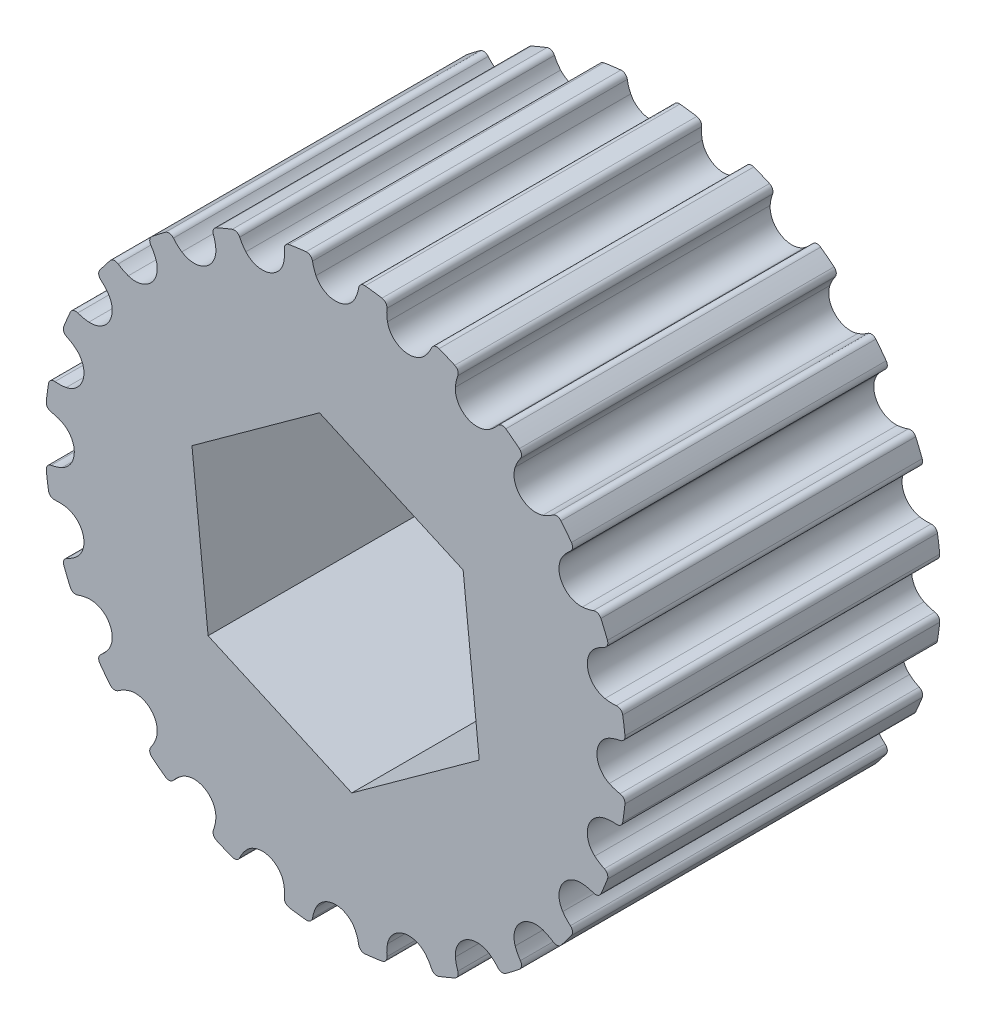
from build123d import *

# Parameters (mm, degrees)
SKETCH2_W          = 8
SKETCH2_H          = 7.3915
CUT_EXTRUDE1_REACH = 17.192
CUT_EXTRUDE1_START = 4
CIRPATTERN1_COUNT  = 24
CUT_EXTRUDE2_REACH = 15.121


with BuildPart() as part:
    # Sketch2 → Revolve1 (revolve)
    with BuildSketch(Plane(origin=(0, 0, 0), x_dir=(0, 0, -1), z_dir=(1, 0, 0))):
        with Locations((0, 3.69575)):
            Rectangle(SKETCH2_W, SKETCH2_H)
    revolve(axis=Axis((0, 0, 4), (0, 0, -1)))

    # Sketch3 → Cut-Extrude1 (cut, up to next)
    with BuildSketch(Plane.XY.offset(CUT_EXTRUDE1_START), mode=Mode.PRIVATE) as cut_extrude1_sk1:
        with BuildLine():
            Line((2.053064506, 7.6455), (-2.413874101, 7.6455))
            Line((-2.413874101, 7.6455), (-2.031951845, 7.106718226))
            ThreePointArc((-2.031951845, 7.106718226), (-1.396358482, 7.258405833), (-0.749852036, 7.35336618))
            ThreePointArc((-0.749852036, 7.35336618), (-0.643527515, 7.323301509), (-0.586639003, 7.228578306))
            ThreePointArc((-0.586639003, 7.228578306), (-0.552752294, 7.087751639), (-0.498876404, 6.953297753))
            ThreePointArc((-0.498876404, 6.953297753), (0, 6.6415), (0.498876404, 6.953297753))
            ThreePointArc((0.498876404, 6.953297753), (0.552752294, 7.087751639), (0.586639003, 7.228578306))
            ThreePointArc((0.586639003, 7.228578306), (0.643527515, 7.323301509), (0.749852036, 7.35336618))
            ThreePointArc((0.749852036, 7.35336618), (1.337715598, 7.269442154), (1.916945123, 7.138598857))
            Line((1.916945123, 7.138598857), (2.053064506, 7.6455))
        make_face()
    cut_extrude1_tool1 = extrude(cut_extrude1_sk1.sketch, amount=-CUT_EXTRUDE1_REACH, mode=Mode.PRIVATE) & part.part
    cut_extrude1 = cut_extrude1_tool1.solids().sort_by_distance((-0.123535, 7.335961, 4))[0]
    add(cut_extrude1, mode=Mode.SUBTRACT)

    # CirPattern1: Cut-Extrude1 ×24 about axis
    cirpattern1_axis = Axis((0, 0, 4), (0, 0, 1))
    for i in range(1, CIRPATTERN1_COUNT):
        add(cut_extrude1.rotate(cirpattern1_axis, i * 360 / CIRPATTERN1_COUNT), mode=Mode.SUBTRACT)

    # Sketch4 → Cut-Extrude2 (cut, up to next)
    with BuildSketch(Plane.XY.offset(4), mode=Mode.PRIVATE) as cut_extrude2_sk1:
        Polygon((0.409787013, -3.978953959), (3.650768715, -1.634591016), (3.240981702, 2.344362943), (-0.409787013, 3.978953959), (-3.650768715, 1.634591016), (-3.240981702, -2.344362943), align=None)
    cut_extrude2_tool1 = extrude(cut_extrude2_sk1.sketch, amount=-CUT_EXTRUDE2_REACH, mode=Mode.PRIVATE) & part.part
    add(cut_extrude2_tool1.solids().sort_by_distance((0, 0, 4))[0], mode=Mode.SUBTRACT)


solid = part.part
